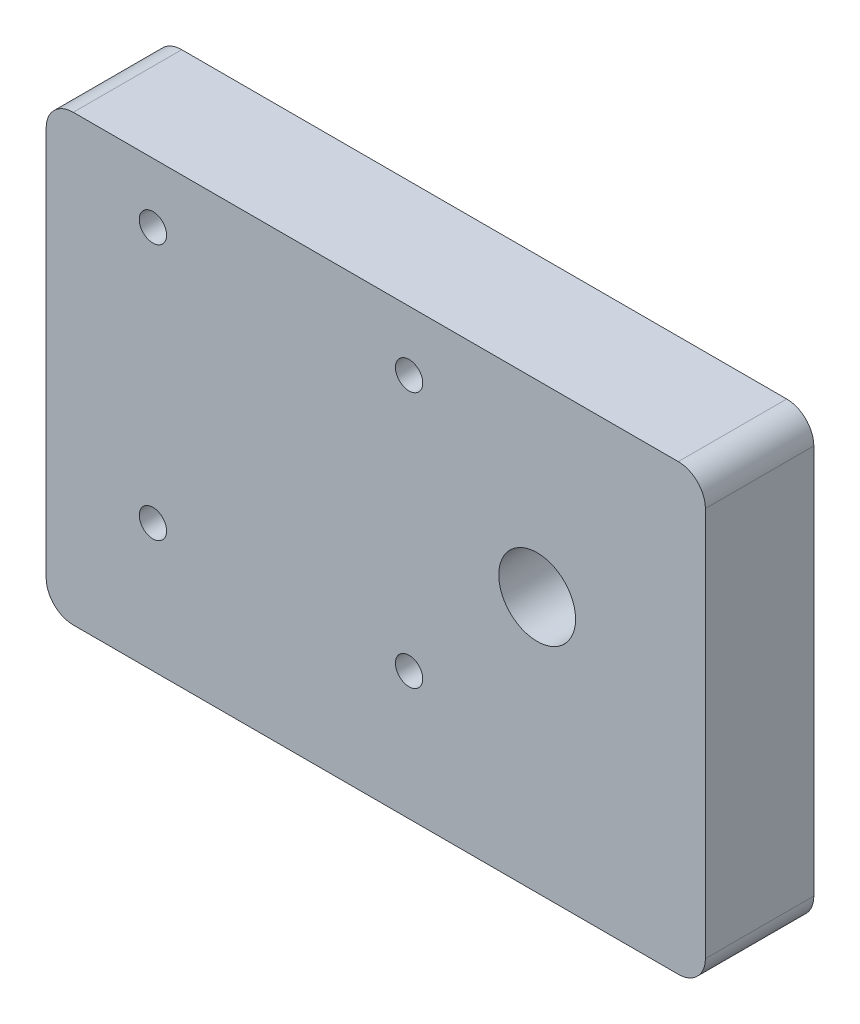
from build123d import *

# Parameters (mm, degrees)
SKETCH1_W           = 72.2
SKETCH1_H           = 44
BOSS_EXTRUDE1_DEPTH = 12.7
BOSS_EXTRUDE2_DEPTH = 12.7
SKETCH1_5_R         = 4.5
SKETCH1_5_R_2       = 1.6
CUT_EXTRUDE3_DEPTH  = 90.878417877
FILLET1_R           = 3.175


with BuildPart() as part:
    # Sketch1 → Boss-Extrude1 (new body)
    with BuildSketch(Plane.XY):
        with Locations((36.1, -22)):
            Rectangle(SKETCH1_W, SKETCH1_H)
    extrude(amount=BOSS_EXTRUDE1_DEPTH)

    # Sketch2 → Boss-Extrude2 (add)
    with BuildSketch(Plane.XY.offset(12.7)):
        Polygon((72.2, -44), (0, -44), (0, 0), (-5, 0), (-5, -52), (72.2, -52), align=None)
    extrude(amount=-BOSS_EXTRUDE2_DEPTH)

    # Sketch1<5> → Cut-Extrude3 (cut, through all)
    with BuildSketch(Plane.XY):
        with Locations((52.5, -22)):
            Circle(SKETCH1_5_R)
        with Locations((7.5, -37)):
            Circle(SKETCH1_5_R_2)
        with Locations((7.5, -7)):
            Circle(SKETCH1_5_R_2)
        with Locations((37.5, -7)):
            Circle(SKETCH1_5_R_2)
        with Locations((37.5, -37)):
            Circle(SKETCH1_5_R_2)
    extrude(amount=CUT_EXTRUDE3_DEPTH, mode=Mode.SUBTRACT)

    # Fillet1
    fillet1_edges = [part.edges().sort_by_distance(p)[0] for p in [
        (72.2, 0, 6.35),
        (-5, 0, 6.35),
        (72.2, -52, 6.35),
        (-5, -52, 6.35),
    ]]
    fillet(fillet1_edges, radius=FILLET1_R)


solid = part.part
